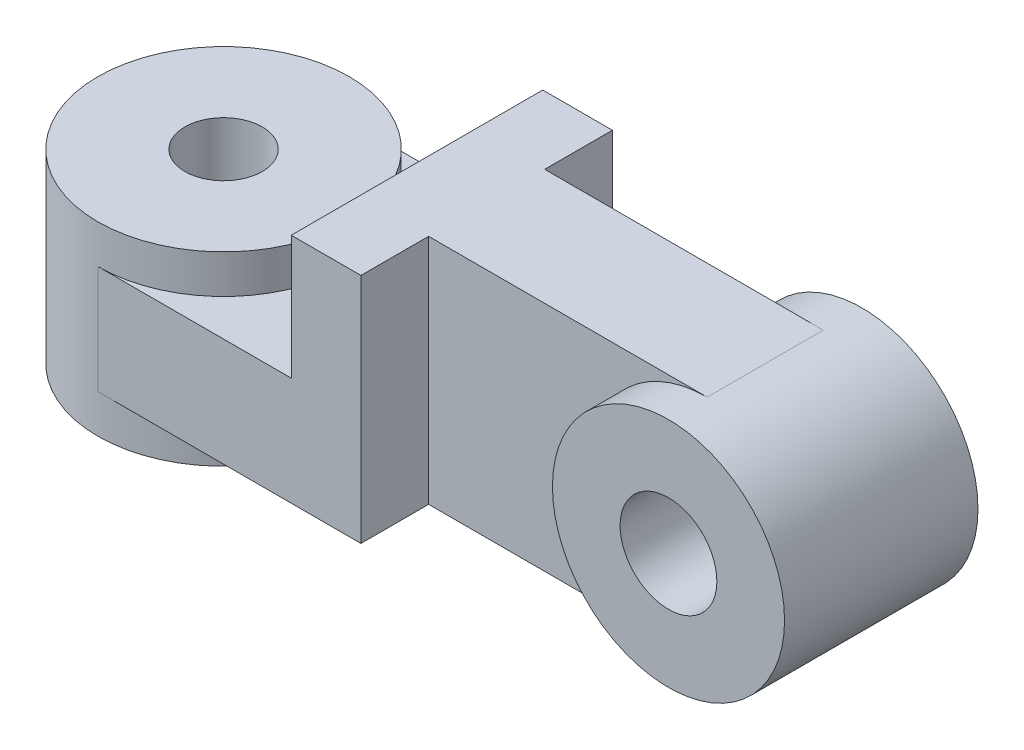
from build123d import *

# Parameters (mm, degrees)
BOSS_EXTRUDE1_DEPTH     = 32.5
SKETCH1_3_W             = 72
SKETCH1_3_H             = 60
BOSS_EXTRUDE2_DEPTH     = 15
BOSS_EXTRUDE3_START     = 10
SKETCH2_R               = 32.5
BOSS_EXTRUDE3_DEPTH     = 48
BOSS_EXTRUDE4_START     = 10
SKETCH3_R               = 30
BOSS_EXTRUDE4_DEPTH     = 50
SKETCH5_R               = 10
CUT_EXTRUDE1_DEPTH      = 118.321140465
CUT_EXTRUDE2_DEPTH      = 132.568423263
CUT_EXTRUDE2_DEPTH_BACK = 132.568423263
SKETCH4_R               = 12.5


with BuildPart() as part:
    # Sketch1 → Boss-Extrude1 (new, symmetric)
    with BuildSketch(Plane.XY):
        Polygon((-68, 28), (-68, 0), (0, 0), (0, 60), (-18, 60), (-18, 28), align=None)
    extrude(amount=BOSS_EXTRUDE1_DEPTH, both=True)

    # Sketch1<3> → Boss-Extrude2 (add, symmetric)
    with BuildSketch(Plane.XY):
        with Locations((36, 30)):
            Rectangle(SKETCH1_3_W, SKETCH1_3_H)
    extrude(amount=BOSS_EXTRUDE2_DEPTH, both=True)

    # Sketch2 → Boss-Extrude3 (add)
    with BuildSketch(Plane(origin=(0, 28, 0), x_dir=(1, 0, 0), z_dir=(0, 1, 0)).offset(BOSS_EXTRUDE3_START)):
        with Locations((-68, 0)):
            Circle(SKETCH2_R)
    extrude(amount=-BOSS_EXTRUDE3_DEPTH)

    # Sketch3 → Boss-Extrude4 (add)
    with BuildSketch(Plane.XY.offset(15).offset(BOSS_EXTRUDE4_START)):
        with Locations((72, 30)):
            Circle(SKETCH3_R)
    extrude(amount=-BOSS_EXTRUDE4_DEPTH)

    # Sketch5 → Cut-Extrude1 (cut, through all)
    with BuildSketch(Plane(origin=(0, 38, 0), x_dir=(1, 0, 0), z_dir=(0, 1, 0))):
        with Locations((-68, 0)):
            Circle(SKETCH5_R)
    extrude(amount=-CUT_EXTRUDE1_DEPTH, mode=Mode.SUBTRACT)

    # Sketch4 → Cut-Extrude2 (cut, two sides: drawn at the far end of the back side and taken through both)
    with BuildSketch(Plane.XY.offset(25).offset(-CUT_EXTRUDE2_DEPTH_BACK)):
        with Locations((72, 30)):
            Circle(SKETCH4_R)
    extrude(amount=CUT_EXTRUDE2_DEPTH + CUT_EXTRUDE2_DEPTH_BACK, mode=Mode.SUBTRACT)


solid = part.part
